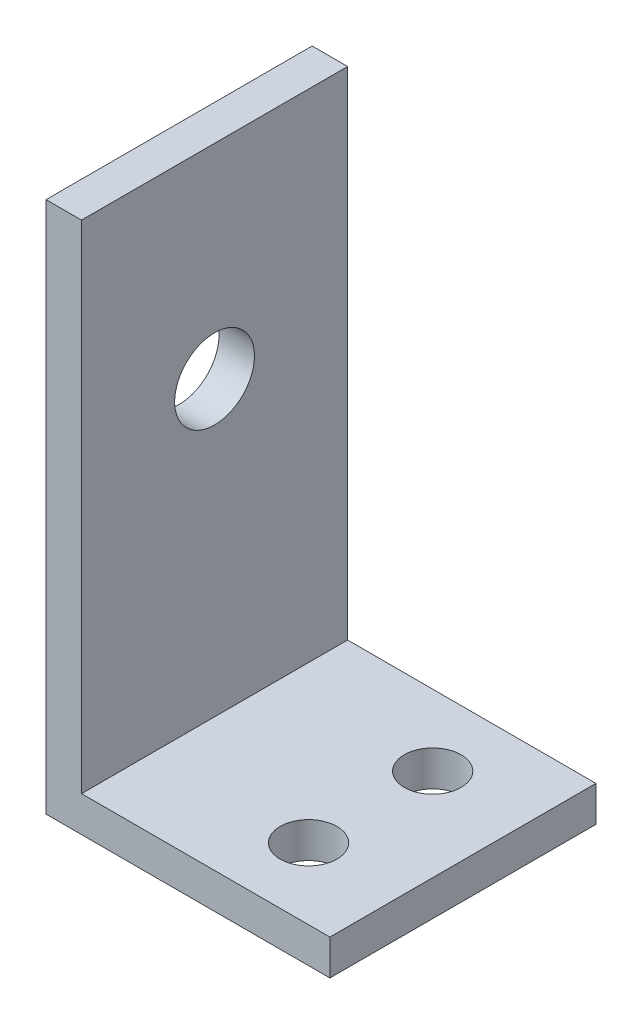
from build123d import *

# Parameters (mm, degrees)
SKETCH1_W                  = 16
SKETCH1_H                  = 15
BOSS_EXTRUDE1_DEPTH        = 2
SKETCH4_W                  = 2
SKETCH4_H                  = 15
BOSS_EXTRUDE4_DEPTH        = 28
F_3_2_3_2_DIAMETER_SLOT1_D = 3.2
M4_CLEARANCE_SLOT1_D       = 4.5


with BuildPart() as part:
    # Sketch1 → Boss-Extrude1 (new body)
    with BuildSketch(Plane(origin=(0, 0, 0), x_dir=(1, 0, 0), z_dir=(0, 1, 0))):
        with Locations((4.176470588, 2.588235294)):
            Rectangle(SKETCH1_W, SKETCH1_H)
    extrude(amount=BOSS_EXTRUDE1_DEPTH)

    # Sketch4 → Boss-Extrude4 (add)
    with BuildSketch(Plane(origin=(0, 2, 0), x_dir=(1, 0, 0), z_dir=(0, 1, 0))):
        with Locations((-2.823529412, 2.588235294)):
            Rectangle(SKETCH4_W, SKETCH4_H)
    extrude(amount=BOSS_EXTRUDE4_DEPTH)

    # Ø3.2 (3.2) Diameter Slot1 (through all)
    with Locations(Plane(origin=(0, 2, 0), x_dir=(1, 0, 0), z_dir=(0, 1, 0))):
        with Locations((6.972823148, 6.088235294), (6.972823148, -0.911764706)):
            Hole(F_3_2_3_2_DIAMETER_SLOT1_D / 2)

    # M4 Clearance Slot1 (through all)
    with Locations(Plane(origin=(-1.823529412, 0, 0), x_dir=(0, 0, -1), z_dir=(1, 0, 0))):
        with Locations((2.588235294, 18.5)):
            Hole(M4_CLEARANCE_SLOT1_D / 2)


solid = part.part
